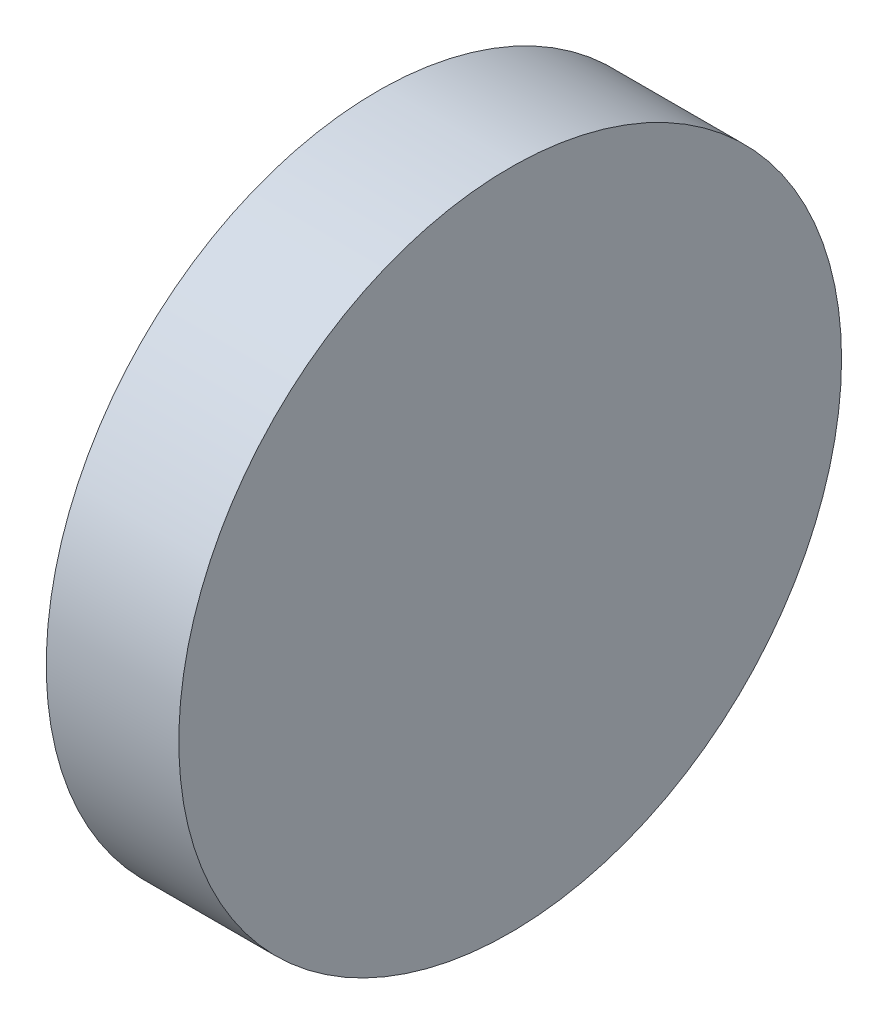
from build123d import *

# Parameters (mm, degrees)
SKETCH1_R           = 12.5
BOSS_EXTRUDE1_DEPTH = 5


with BuildPart() as part:
    # Sketch1 → Boss-Extrude1 (new body)
    with BuildSketch(Plane(origin=(0, 0, 0), x_dir=(0, 0, -1), z_dir=(1, 0, 0))):
        Circle(SKETCH1_R)
    extrude(amount=BOSS_EXTRUDE1_DEPTH)


solid = part.part
